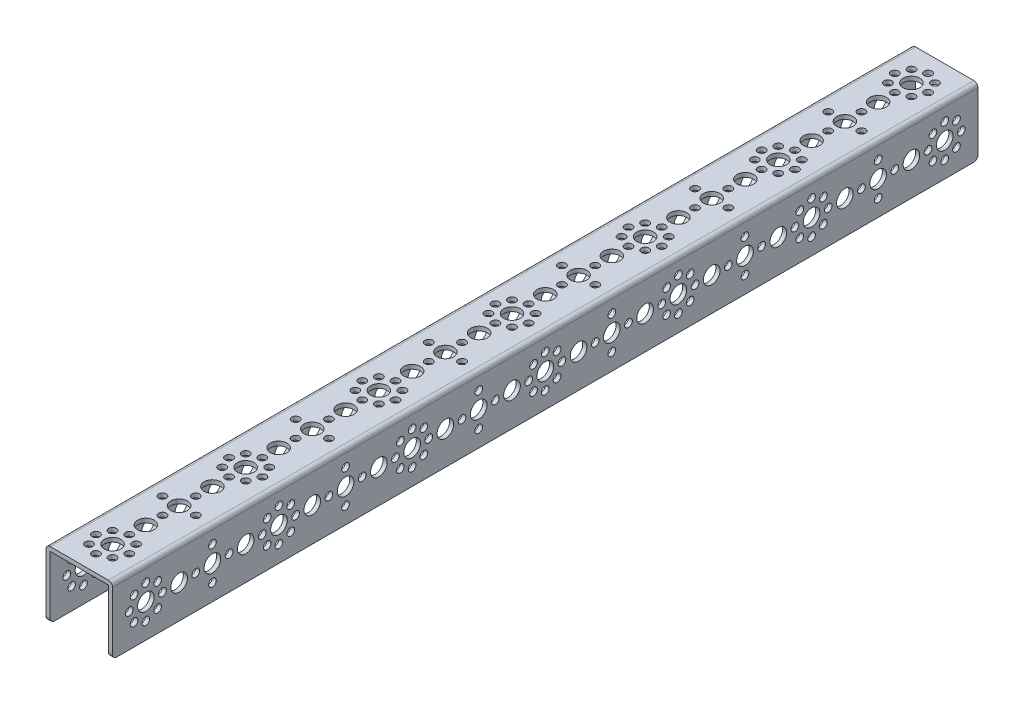
from build123d import *

# Parameters (mm, degrees)
SKETCH1_W                      = 32
SKETCH1_H                      = 416
BOSS_EXTRUDE1_DEPTH            = 32
SKETCH2_W                      = 28
SKETCH2_H                      = 30
CUT_EXTRUDE1_DEPTH             = 417.614930121
F_8_0_8_DIAMETER_HOLE1_D       = 8
F_8_0_8_DIAMETER_HOLE1_DEPTH   = 2
F_3_7_3_7_DIAMETER_HOLE1_D     = 3.7
F_3_7_3_7_DIAMETER_HOLE1_DEPTH = 2
F_8_0_8_DIAMETER_HOLE2_D       = 8
F_3_7_3_7_DIAMETER_HOLE2_D     = 3.7
F_8_0_8_DIAMETER_HOLE3_D       = 8
F_8_0_8_DIAMETER_HOLE3_DEPTH   = 32
F_3_7_3_7_DIAMETER_HOLE3_D     = 3.7
F_3_7_3_7_DIAMETER_HOLE3_DEPTH = 32
FILLET1_R                      = 2


with BuildPart() as part:
    # Sketch1 → Boss-Extrude1 (new body)
    with BuildSketch(Plane(origin=(-16, 0, 0), x_dir=(0, -1, 0), z_dir=(-1, 0, 0))):
        with Locations((0, -208)):
            Rectangle(SKETCH1_W, SKETCH1_H)
    extrude(amount=-BOSS_EXTRUDE1_DEPTH)

    # Sketch2 → Cut-Extrude1 (cut, through all)
    with BuildSketch(Plane.XY):
        with Locations((0, -1)):
            Rectangle(SKETCH2_W, SKETCH2_H)
    extrude(amount=-CUT_EXTRUDE1_DEPTH, mode=Mode.SUBTRACT)

    # Ø8.0 (8) Diameter Hole1
    with Locations(Plane.ZY.offset(-14)):
        with Locations((-80, 0), (-112, 0), (-16, 0), (-48, 0), (-128, 0), (-96, 0.175415159), (-64, 0), (-32, 0), (-272, 0), (-336, 0), (-304, 0), (-400, 0), (-368, 0), (-288, 0), (-320, -0.175415159), (-352, 0), (-384, 0), (-208, 0), (-240, 0), (-144, 0), (-176, 0), (-256, 0), (-224, 0.175415159), (-192, 0), (-160, 0)):
            Hole(F_8_0_8_DIAMETER_HOLE1_D / 2, depth=F_8_0_8_DIAMETER_HOLE1_DEPTH)

    # Ø3.7 (3.7) Diameter Hole1
    with Locations(Plane.ZY.offset(-14)):
        with Locations((-74.34, -5.66), (-85.66, -5.66), (-85.66, 5.66), (-74.34, 5.66), (-80, 8), (-80, -8), (-72, 0), (-88, 0), (-112, 8), (-112, -8), (-104, 0), (-120, 0), (-21.66, -5.66), (-21.66, 5.66), (-8, 0), (-10.34, -5.66), (-10.34, 5.66), (-16, 8), (-48, 8), (-48, -8), (-40, 0), (-56, 0), (-16, -8), (-24, 0), (-277.66, -5.66), (-277.66, 5.66), (-264, 0), (-266.34, -5.66), (-266.34, 5.66), (-272, 8), (-272, -8), (-280, 0), (-341.66, 5.66), (-330.34, 5.66), (-330.34, -5.66), (-341.66, -5.66), (-336, -8), (-336, 8), (-344, 0), (-328, 0), (-304, -8), (-304, 8), (-312, 0), (-296, 0), (-405.66, 5.66), (-394.34, 5.66), (-394.34, -5.66), (-405.66, -5.66), (-400, -8), (-400, 8), (-408, 0), (-392, 0), (-368, -8), (-368, 8), (-376, 0), (-360, 0), (-202.34, -5.66), (-213.66, -5.66), (-213.66, 5.66), (-202.34, 5.66), (-208, 8), (-208, -8), (-200, 0), (-216, 0), (-240, 8), (-240, -8), (-232, 0), (-248, 0), (-149.66, -5.66), (-149.66, 5.66), (-136, 0), (-138.34, -5.66), (-138.34, 5.66), (-144, 8), (-176, 8), (-176, -8), (-168, 0), (-184, 0), (-144, -8), (-152, 0)):
            Hole(F_3_7_3_7_DIAMETER_HOLE1_D / 2, depth=F_3_7_3_7_DIAMETER_HOLE1_DEPTH)

    # Ø8.0 (8) Diameter Hole2 (through all)
    with Locations(Plane(origin=(0, 14, 0), x_dir=(-1, 0, 0), z_dir=(0, -1, 0))):
        with Locations((0, 336), (0, 304), (0, 400), (0, 368), (0, 288), (-0.175415159, 320), (0, 352), (0, 384), (0, 144), (0, 80), (0, 112), (0, 16), (0, 48), (0, 128), (0.175415159, 96), (0, 64), (0, 32), (0, 208), (0, 176), (0, 272), (0, 240), (0, 160), (-0.175415159, 192), (0, 224), (0, 256)):
            Hole(F_8_0_8_DIAMETER_HOLE2_D / 2)

    # Ø3.7 (3.7) Diameter Hole2 (through all)
    with Locations(Plane(origin=(0, 14, 0), x_dir=(-1, 0, 0), z_dir=(0, -1, 0))):
        with Locations((5.66, 341.66), (5.66, 330.34), (-5.66, 330.34), (-5.66, 341.66), (-8, 336), (8, 336), (0, 344), (0, 328), (-8, 304), (8, 304), (0, 312), (0, 296), (5.66, 394.34), (-5.66, 394.34), (0, 408), (5.66, 405.66), (-5.66, 405.66), (-8, 400), (-8, 368), (8, 368), (0, 376), (0, 360), (8, 400), (0, 392), (5.66, 138.34), (-5.66, 138.34), (0, 152), (5.66, 149.66), (-5.66, 149.66), (-8, 144), (8, 144), (0, 136), (-5.66, 74.34), (-5.66, 85.66), (5.66, 85.66), (5.66, 74.34), (8, 80), (-8, 80), (0, 72), (0, 88), (8, 112), (-8, 112), (0, 104), (0, 120), (-5.66, 10.34), (-5.66, 21.66), (5.66, 21.66), (5.66, 10.34), (8, 16), (-8, 16), (0, 8), (0, 24), (8, 48), (-8, 48), (0, 40), (0, 56), (5.66, 213.66), (5.66, 202.34), (-5.66, 202.34), (-5.66, 213.66), (-8, 208), (8, 208), (0, 216), (0, 200), (-8, 176), (8, 176), (0, 184), (0, 168), (5.66, 266.34), (-5.66, 266.34), (0, 280), (5.66, 277.66), (-5.66, 277.66), (-8, 272), (-8, 240), (8, 240), (0, 248), (0, 232), (8, 272), (0, 264)):
            Hole(F_3_7_3_7_DIAMETER_HOLE2_D / 2)

    # Ø8.0 (8) Diameter Hole3
    with Locations(Plane.ZY.offset(16)):
        with Locations((-80, 0), (-112, 0), (-16, 0), (-48, 0), (-128, 0), (-96, 0.175415159), (-64, 0), (-32, 0), (-272, 0), (-336, 0), (-304, 0), (-400, 0), (-368, 0), (-288, 0), (-320, -0.175415159), (-352, 0), (-384, 0), (-208, 0), (-240, 0), (-144, 0), (-176, 0), (-256, 0), (-224, 0.175415159), (-192, 0), (-160, 0)):
            Hole(F_8_0_8_DIAMETER_HOLE3_D / 2, depth=F_8_0_8_DIAMETER_HOLE3_DEPTH)

    # Ø3.7 (3.7) Diameter Hole3
    with Locations(Plane.ZY.offset(16)):
        with Locations((-74.34, -5.66), (-85.66, -5.66), (-85.66, 5.66), (-74.34, 5.66), (-80, 8), (-80, -8), (-72, 0), (-88, 0), (-112, 8), (-112, -8), (-104, 0), (-120, 0), (-21.66, -5.66), (-21.66, 5.66), (-8, 0), (-10.34, -5.66), (-10.34, 5.66), (-16, 8), (-48, 8), (-48, -8), (-40, 0), (-56, 0), (-16, -8), (-24, 0), (-277.66, -5.66), (-277.66, 5.66), (-264, 0), (-266.34, -5.66), (-266.34, 5.66), (-272, 8), (-272, -8), (-280, 0), (-341.66, 5.66), (-330.34, 5.66), (-330.34, -5.66), (-341.66, -5.66), (-336, -8), (-336, 8), (-344, 0), (-328, 0), (-304, -8), (-304, 8), (-312, 0), (-296, 0), (-405.66, 5.66), (-394.34, 5.66), (-394.34, -5.66), (-405.66, -5.66), (-400, -8), (-400, 8), (-408, 0), (-392, 0), (-368, -8), (-368, 8), (-376, 0), (-360, 0), (-202.34, -5.66), (-213.66, -5.66), (-213.66, 5.66), (-202.34, 5.66), (-208, 8), (-208, -8), (-200, 0), (-216, 0), (-240, 8), (-240, -8), (-232, 0), (-248, 0), (-149.66, -5.66), (-149.66, 5.66), (-136, 0), (-138.34, -5.66), (-138.34, 5.66), (-144, 8), (-176, 8), (-176, -8), (-168, 0), (-184, 0), (-144, -8), (-152, 0)):
            Hole(F_3_7_3_7_DIAMETER_HOLE3_D / 2, depth=F_3_7_3_7_DIAMETER_HOLE3_DEPTH)

    # Fillet1
    fillet1_edges = [part.edges().sort_by_distance(p)[0] for p in [
        (16, 16, -208),
        (-15, -16, 0),
        (-15, -16, -416),
        (-16, 16, -208),
        (15, -16, -416),
        (15, -16, 0),
    ]]
    fillet(fillet1_edges, radius=FILLET1_R)


solid = part.part
